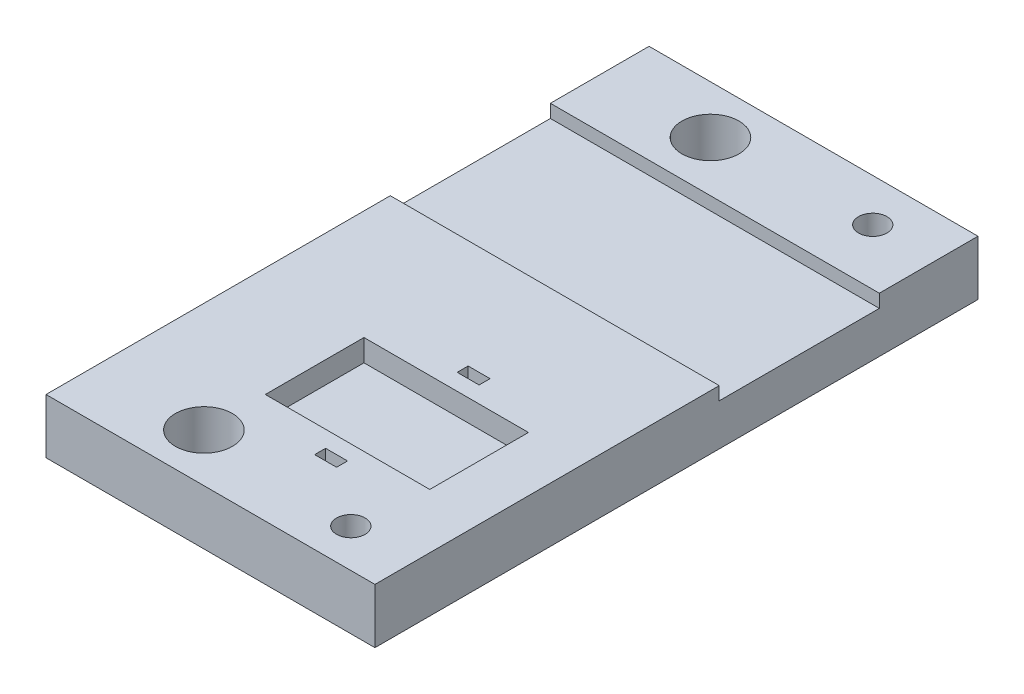
from build123d import *

# Parameters (mm, degrees)
SKETCH1_W               = 38.1
SKETCH1_H               = 69.85
SKETCH1_R               = 3.302
SKETCH1_R_2             = 1.651
BOSS_EXTRUDE1_DEPTH     = 6.35
SKETCH2_W               = 19.05
SKETCH2_H               = 11.43
CUT_EXTRUDE1_DEPTH      = 2.54
CUT_EXTRUDE2_DEPTH      = 70.390828962
CUT_EXTRUDE2_DEPTH_BACK = 70.390828962
SKETCH5_W               = 2.54
SKETCH5_H               = 1.27
SKETCH6_W               = 2.54
SKETCH6_H               = 15.24
CUT_EXTRUDE3_DEPTH      = 1.016
SKETCH7_W               = 38.1
SKETCH7_H               = 18.542
CUT_EXTRUDE4_DEPTH      = 1.524


with BuildPart() as part:
    # Sketch1 → Boss-Extrude1 (new body)
    with BuildSketch(Plane(origin=(0, 0, 0), x_dir=(1, 0, 0), z_dir=(0, 1, 0))):
        with Locations((6.35, 29.337)):
            Rectangle(SKETCH1_W, SKETCH1_H)
        with Locations(Location((0, 0, 0), (0, 0, 270))):
            Circle(SKETCH1_R, mode=Mode.SUBTRACT)
        with Locations(Location((0, 58.674, 0), (0, 0, 270))):
            Circle(SKETCH1_R, mode=Mode.SUBTRACT)
        with Locations(Location((18.161, 59.309, 0), (0, 0, 270))):
            Circle(SKETCH1_R_2, mode=Mode.SUBTRACT)
        with Locations(Location((18.161, -1.143, 0), (0, 0, 270))):
            Circle(SKETCH1_R_2, mode=Mode.SUBTRACT)
    extrude(amount=BOSS_EXTRUDE1_DEPTH)

    # Sketch2 → Cut-Extrude1 (cut)
    with BuildSketch(Plane(origin=(0, 6.35, 0), x_dir=(1, 0, 0), z_dir=(0, 1, 0))):
        with Locations((9.525, 12.827)):
            Rectangle(SKETCH2_W, SKETCH2_H)
    extrude(amount=-CUT_EXTRUDE1_DEPTH, mode=Mode.SUBTRACT)

    # Sketch5 → Cut-Extrude2 (cut, two sides: drawn at the far end of the back side and taken through both)
    with BuildSketch(Plane(origin=(0, 6.35, 0), x_dir=(1, 0, 0), z_dir=(0, 1, 0)).offset(-CUT_EXTRUDE2_DEPTH_BACK)):
        with Locations((10.16, 21.082)):
            Rectangle(SKETCH5_W, SKETCH5_H)
        with Locations((10.16, 4.572)):
            Rectangle(SKETCH5_W, SKETCH5_H)
    extrude(amount=CUT_EXTRUDE2_DEPTH + CUT_EXTRUDE2_DEPTH_BACK, mode=Mode.SUBTRACT)

    # Sketch6 → Cut-Extrude3 (cut)
    with BuildSketch(Plane.XZ):
        with Locations((10.16, -12.827)):
            Rectangle(SKETCH6_W, SKETCH6_H)
    extrude(amount=-CUT_EXTRUDE3_DEPTH, mode=Mode.SUBTRACT)

    # Sketch7 → Cut-Extrude4 (cut)
    with BuildSketch(Plane(origin=(0, 6.35, 0), x_dir=(1, 0, 0), z_dir=(0, 1, 0))):
        with Locations((6.35, 43.561)):
            Rectangle(SKETCH7_W, SKETCH7_H)
    extrude(amount=-CUT_EXTRUDE4_DEPTH, mode=Mode.SUBTRACT)


solid = part.part
